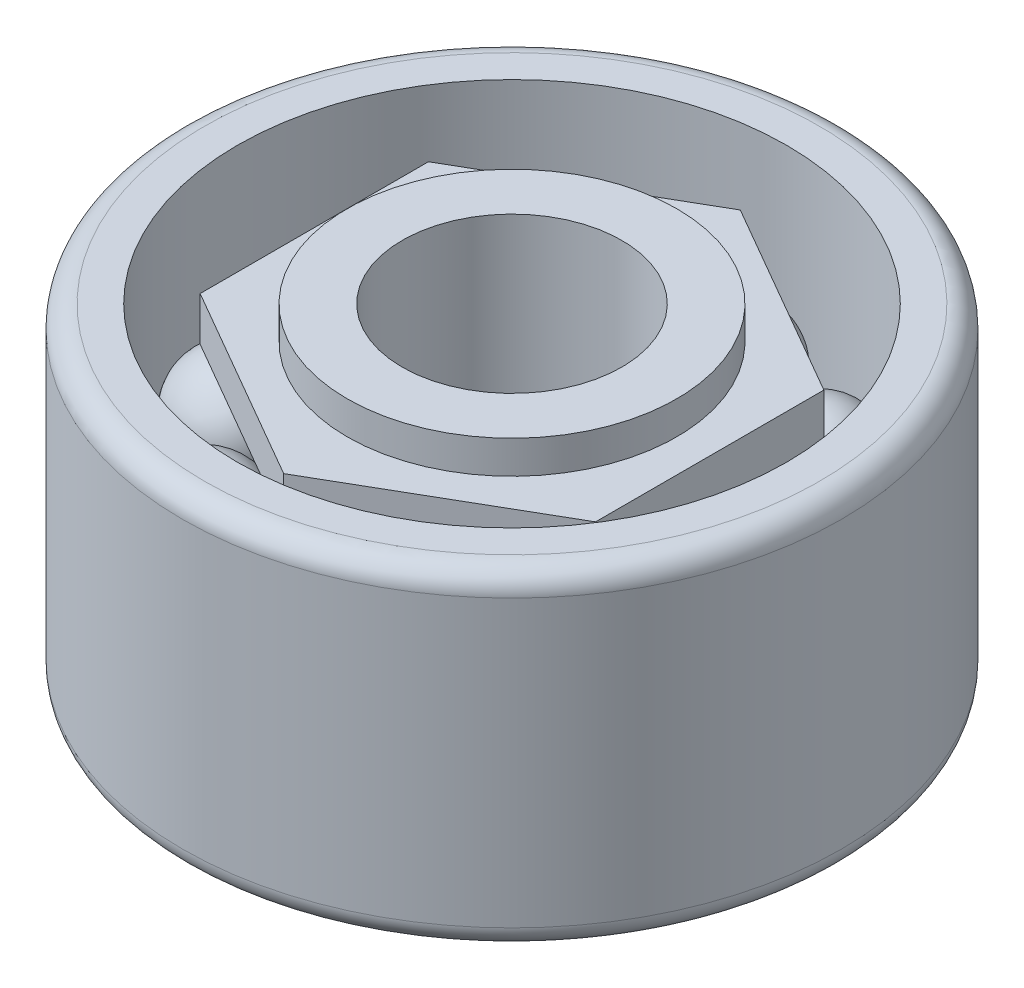
from build123d import *

# Parameters (mm, degrees)
SKETCH1_R             = 0.75
SKETCH1_R_2           = 0.5
BOSS_EXTRUDE1_DEPTH   = 0.75
SKETCH1_R_3           = 1.5
SKETCH1_R_4           = 1.25
BOSS_EXTRUDE1_2_DEPTH = 0.75
BOSS_EXTRUDE2_START   = 0.6
SKETCH1_3_R           = 0.75
BOSS_EXTRUDE2_DEPTH   = 0.2
BOSS_EXTRUDE3_START   = -0.4
SKETCH1_4_R           = 0.75
BOSS_EXTRUDE3_DEPTH   = 0.2
CIRPATTERN4_COUNT     = 10
FILLET1_R             = 0.1


with BuildPart() as part:
    # Sketch1 → Boss-Extrude1 (new, symmetric)
    with BuildSketch(Plane(origin=(0, 0, 0), x_dir=(1, 0, 0), z_dir=(0, 1, 0))):
        with Locations(Location((0, 0, 0), (0, 0, 270))):
            Circle(SKETCH1_R)
        with Locations(Location((0, 0, 0), (0, 0, 270))):
            Circle(SKETCH1_R_2, mode=Mode.SUBTRACT)
    extrude(amount=BOSS_EXTRUDE1_DEPTH, both=True)

    # Sketch1<3> → Boss-Extrude2 (add)
    with BuildSketch(Plane(origin=(0, 0, 0), x_dir=(1, 0, 0), z_dir=(0, 1, 0)).offset(BOSS_EXTRUDE2_START)):
        Polygon((0, 1.039230485), (-0.9, 0.519615242), (-0.9, -0.519615242), (0, -1.039230485), (0.9, -0.519615242), (0.9, 0.519615242), align=None)
        with Locations(Location((0, 0, 0), (0, 0, 270))):
            Circle(SKETCH1_3_R, mode=Mode.SUBTRACT)
    extrude(amount=-BOSS_EXTRUDE2_DEPTH)

    # Sketch1<4> → Boss-Extrude3 (add)
    with BuildSketch(Plane(origin=(0, 0, 0), x_dir=(1, 0, 0), z_dir=(0, 1, 0)).offset(BOSS_EXTRUDE3_START)):
        Polygon((0, 1.039230485), (-0.9, 0.519615242), (-0.9, -0.519615242), (0, -1.039230485), (0.9, -0.519615242), (0.9, 0.519615242), align=None)
        with Locations(Location((0, 0, 0), (0, 0, 270))):
            Circle(SKETCH1_4_R, mode=Mode.SUBTRACT)
    extrude(amount=-BOSS_EXTRUDE3_DEPTH)


with BuildPart() as body_2:
    # Sketch1 → Boss-Extrude1 2 (new, symmetric)
    with BuildSketch(Plane(origin=(0, 0, 0), x_dir=(1, 0, 0), z_dir=(0, 1, 0))):
        with Locations(Location((0, 0, 0), (0, 0, 270))):
            Circle(SKETCH1_R_3)
        with Locations(Location((0, 0, 0), (0, 0, 270))):
            Circle(SKETCH1_R_4, mode=Mode.SUBTRACT)
    extrude(amount=BOSS_EXTRUDE1_2_DEPTH, both=True)

    # Fillet1
    fillet1_edges = [body_2.edges().sort_by_distance(p)[0] for p in [
        (0, 0.75, -1.5),
        (0, -0.75, -1.5),
    ]]
    fillet(fillet1_edges, radius=FILLET1_R)


with BuildPart() as body_3:
    # Sketch2 → Revolve1 (revolve)
    with BuildSketch(Plane(origin=(0, 0, 0), x_dir=(0, 0, -1), z_dir=(1, 0, 0))):
        with BuildLine():
            ThreePointArc((0.75, 0), (1, 0.25), (1.25, 0))
            Line((1.25, 0), (0.75, 0))
        make_face()
    revolve(axis=Axis((0, 0, -0.75), (0, 0, -1)))


with BuildPart() as cirpattern4_1:
    # CirPattern4: pattern copy
    add(body_3.part.rotate(Axis((0, 0, 0), (0, 1, 0)), 1 * 360 / CIRPATTERN4_COUNT))


with BuildPart() as cirpattern4_2:
    # CirPattern4: pattern copy
    add(body_3.part.rotate(Axis((0, 0, 0), (0, 1, 0)), 2 * 360 / CIRPATTERN4_COUNT))


with BuildPart() as cirpattern4_3:
    # CirPattern4: pattern copy
    add(body_3.part.rotate(Axis((0, 0, 0), (0, 1, 0)), 3 * 360 / CIRPATTERN4_COUNT))


with BuildPart() as cirpattern4_4:
    # CirPattern4: pattern copy
    add(body_3.part.rotate(Axis((0, 0, 0), (0, 1, 0)), 4 * 360 / CIRPATTERN4_COUNT))


with BuildPart() as cirpattern4_5:
    # CirPattern4: pattern copy
    add(body_3.part.rotate(Axis((0, 0, 0), (0, 1, 0)), 5 * 360 / CIRPATTERN4_COUNT))


with BuildPart() as cirpattern4_6:
    # CirPattern4: pattern copy
    add(body_3.part.rotate(Axis((0, 0, 0), (0, 1, 0)), 6 * 360 / CIRPATTERN4_COUNT))


with BuildPart() as cirpattern4_7:
    # CirPattern4: pattern copy
    add(body_3.part.rotate(Axis((0, 0, 0), (0, 1, 0)), 7 * 360 / CIRPATTERN4_COUNT))


with BuildPart() as cirpattern4_8:
    # CirPattern4: pattern copy
    add(body_3.part.rotate(Axis((0, 0, 0), (0, 1, 0)), 8 * 360 / CIRPATTERN4_COUNT))


with BuildPart() as cirpattern4_9:
    # CirPattern4: pattern copy
    add(body_3.part.rotate(Axis((0, 0, 0), (0, 1, 0)), 9 * 360 / CIRPATTERN4_COUNT))


solid = Compound([part.part, body_2.part, body_3.part, cirpattern4_1.part, cirpattern4_2.part, cirpattern4_3.part, cirpattern4_4.part, cirpattern4_5.part, cirpattern4_6.part, cirpattern4_7.part, cirpattern4_8.part, cirpattern4_9.part])
